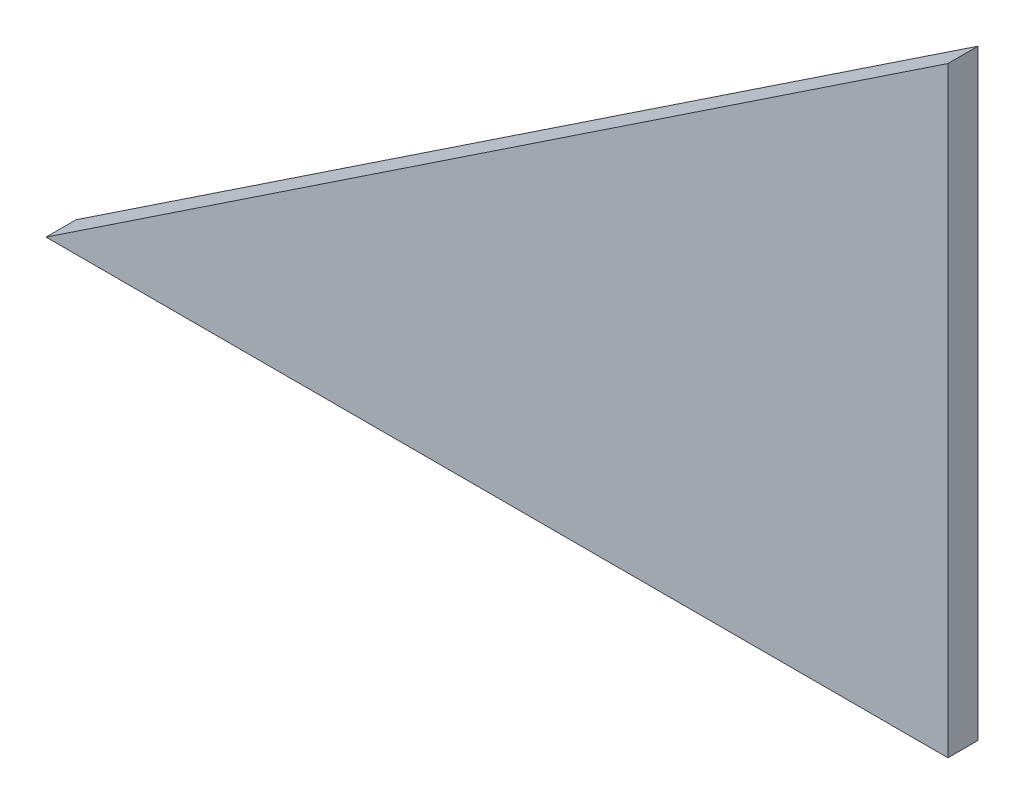
from build123d import *

# Parameters (mm, degrees)
BOSS_EXTRUDE1_DEPTH = 1.27


with BuildPart() as part:
    # Sketch1 → Boss-Extrude1 (new body)
    with BuildSketch(Plane(origin=(0, 0, 23.676486755), x_dir=(-1, 0, 0), z_dir=(0, 0, -1))):
        Polygon((-196.809631061, 11.960081074), (-196.809631061, 37.360081074), (-158.709631061, 11.960081074), align=None)
    extrude(amount=BOSS_EXTRUDE1_DEPTH)


solid = part.part
